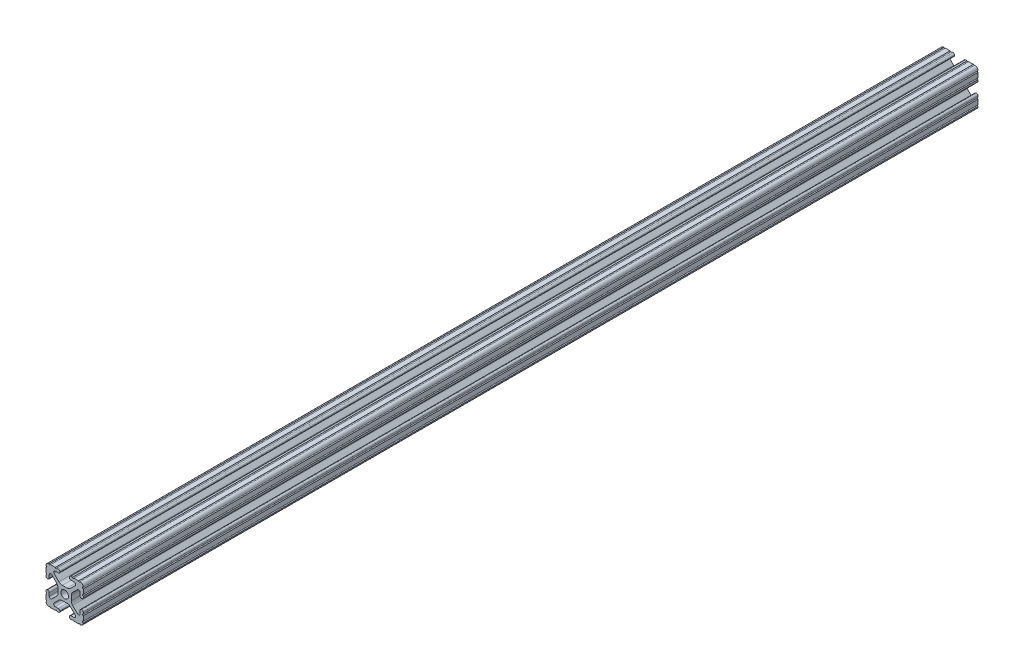
from build123d import *

# Parameters (mm, degrees)
SKETCH1_R           = 2.6035
BOSS_EXTRUDE1_DEPTH = 609.6


with BuildPart() as part:
    # Sketch1 → Boss-Extrude1 (new body)
    with BuildSketch(Plane(origin=(0, 0, -609.6), x_dir=(-1, 0, 0), z_dir=(0, 0, -1))):
        with BuildLine():
            Line((3.952270256, -5.423690504), (7.179650491, -8.645192518))
            ThreePointArc((7.179650491, -8.645192518), (7.41473082, -9.822813122), (6.416408326, -10.4902))
            Line((6.416408326, -10.4902), (4.287512408, -10.4902))
            ThreePointArc((4.287512408, -10.4902), (3.545748623, -10.79744862), (3.238500003, -11.539212405))
            Line((3.238500003, -11.539212405), (3.238500003, -11.650987595))
            ThreePointArc((3.238500003, -11.650987595), (3.545748623, -12.39275138), (4.287512408, -12.7))
            Line((4.287512408, -12.7), (5.317126732, -12.7))
            ThreePointArc((5.317126732, -12.7), (5.825126732, -12.192), (6.333126732, -12.7))
            Line((6.333126732, -12.7), (9.550443135, -12.7))
            ThreePointArc((9.550443135, -12.7), (10.058366883, -12.192000008), (10.566443107, -12.699847501))
            ThreePointArc((10.566443107, -12.699847501), (12.08253777, -12.082507268), (12.699846988, -10.566399977))
            ThreePointArc((12.699846988, -10.566399977), (12.192000032, -10.058323481), (12.700000025, -9.5504))
            Line((12.700000025, -9.5504), (12.700000025, -6.3330836))
            ThreePointArc((12.700000025, -6.3330836), (12.192000025, -5.8250836), (12.700000025, -5.3170836))
            Line((12.700000025, -5.3170836), (12.700000025, -4.287469302))
            ThreePointArc((12.700000025, -4.287469302), (12.392751402, -3.545705507), (11.650987607, -3.238456884))
            Line((11.650987607, -3.238456884), (11.539212418, -3.238456884))
            ThreePointArc((11.539212418, -3.238456884), (10.797448628, -3.545705505), (10.490200006, -4.287469295))
            Line((10.490200006, -4.287469295), (10.490200006, -6.402089022))
            ThreePointArc((10.490200006, -6.402089022), (9.856505079, -7.35106794), (8.737131356, -7.129408934))
            Line((8.737131356, -7.129408934), (5.441005839, -3.840816473))
            ThreePointArc((5.441005839, -3.840816473), (4.750877968, -2.809883099), (4.5085, -1.593185511))
            Line((4.5085, -1.593185511), (4.5085, 1.593185511))
            ThreePointArc((4.5085, 1.593185511), (4.750877968, 2.809883097), (5.441005836, 3.84081647))
            Line((5.441005836, 3.84081647), (8.737131354, 7.129408937))
            ThreePointArc((8.737131354, 7.129408937), (9.856505078, 7.351067944), (10.490200006, 6.402089026))
            Line((10.490200006, 6.402089026), (10.490200006, 4.287469295))
            ThreePointArc((10.490200006, 4.287469295), (10.797448628, 3.545705505), (11.539212418, 3.238456884))
            Line((11.539212418, 3.238456884), (11.650987607, 3.238456884))
            ThreePointArc((11.650987607, 3.238456884), (12.392751402, 3.545705507), (12.700000025, 4.287469302))
            Line((12.700000025, 4.287469302), (12.700000025, 5.3170836))
            ThreePointArc((12.700000025, 5.3170836), (12.192000025, 5.8250836), (12.700000025, 6.3330836))
            Line((12.700000025, 6.3330836), (12.700000025, 9.5504))
            ThreePointArc((12.700000025, 9.5504), (12.192000031, 10.058323481), (12.699846988, 10.566399977))
            ThreePointArc((12.699846988, 10.566399977), (12.082537769, 12.082507268), (10.566443107, 12.699847501))
            ThreePointArc((10.566443107, 12.699847501), (10.058366883, 12.192000008), (9.550443135, 12.7))
            Line((9.550443135, 12.7), (6.333126732, 12.7))
            ThreePointArc((6.333126732, 12.7), (5.825126732, 12.192), (5.317126732, 12.7))
            Line((5.317126732, 12.7), (4.287512408, 12.7))
            ThreePointArc((4.287512408, 12.7), (3.545748623, 12.39275138), (3.238500003, 11.650987595))
            Line((3.238500003, 11.650987595), (3.238500003, 11.539212405))
            ThreePointArc((3.238500003, 11.539212405), (3.545748623, 10.79744862), (4.287512408, 10.4902))
            Line((4.287512408, 10.4902), (6.476788589, 10.4902))
            ThreePointArc((6.476788589, 10.4902), (7.432222377, 9.851404219), (7.207036002, 8.72437056))
            Line((7.207036002, 8.72437056), (3.89827257, 5.423169047))
            ThreePointArc((3.89827257, 5.423169047), (2.869120215, 4.736787961), (1.655778398, 4.495799999))
            Line((1.655778398, 4.495799999), (-1.655778403, 4.495799999))
            ThreePointArc((-1.655778403, 4.495799999), (-2.86912022, 4.736787961), (-3.898272574, 5.423169047))
            Line((-3.898272574, 5.423169047), (-7.207036005, 8.724370563))
            ThreePointArc((-7.207036005, 8.724370563), (-7.43222238, 9.85140422), (-6.476788593, 10.4902))
            Line((-6.476788593, 10.4902), (-4.287512402, 10.4902))
            ThreePointArc((-4.287512402, 10.4902), (-3.545748617, 10.79744862), (-3.238499997, 11.539212405))
            Line((-3.238499997, 11.539212405), (-3.238499997, 11.650987595))
            ThreePointArc((-3.238499997, 11.650987595), (-3.545748617, 12.39275138), (-4.287512402, 12.7))
            Line((-4.287512402, 12.7), (-5.317126726, 12.7))
            ThreePointArc((-5.317126726, 12.7), (-5.825126726, 12.192), (-6.333126726, 12.7))
            Line((-6.333126726, 12.7), (-9.550443129, 12.7))
            ThreePointArc((-9.550443129, 12.7), (-10.058366877, 12.192000009), (-10.566443101, 12.699847501))
            ThreePointArc((-10.566443101, 12.699847501), (-12.082537764, 12.082507268), (-12.699846982, 10.566399977))
            ThreePointArc((-12.699846982, 10.566399977), (-12.192000006, 10.058323491), (-12.7, 9.5504))
            Line((-12.7, 9.5504), (-12.7, 6.3330836))
            ThreePointArc((-12.7, 6.3330836), (-12.192, 5.8250836), (-12.7, 5.3170836))
            Line((-12.7, 5.3170836), (-12.7, 4.287469302))
            ThreePointArc((-12.7, 4.287469302), (-12.392751376, 3.545705507), (-11.650987582, 3.238456884))
            Line((-11.650987582, 3.238456884), (-11.539212393, 3.238456884))
            ThreePointArc((-11.539212393, 3.238456884), (-10.797448603, 3.545705505), (-10.490199981, 4.287469295))
            Line((-10.490199981, 4.287469295), (-10.490199981, 6.402089031))
            ThreePointArc((-10.490199981, 6.402089031), (-9.856505054, 7.351067949), (-8.737131331, 7.129408942))
            Line((-8.737131331, 7.129408942), (-5.441005817, 3.840816485))
            ThreePointArc((-5.441005817, 3.840816485), (-4.750877946, 2.80988311), (-4.508499978, 1.593185522))
            Line((-4.508499978, 1.593185522), (-4.508499978, -1.593185505))
            ThreePointArc((-4.508499978, -1.593185505), (-4.750877945, -2.809883091), (-5.441005814, -3.840816464))
            Line((-5.441005814, -3.840816464), (-8.73713133, -7.129408929))
            ThreePointArc((-8.73713133, -7.129408929), (-9.856505053, -7.351067936), (-10.490199981, -6.402089018))
            Line((-10.490199981, -6.402089018), (-10.490199981, -4.287469295))
            ThreePointArc((-10.490199981, -4.287469295), (-10.797448603, -3.545705505), (-11.539212393, -3.238456884))
            Line((-11.539212393, -3.238456884), (-11.650987582, -3.238456884))
            ThreePointArc((-11.650987582, -3.238456884), (-12.392751376, -3.545705507), (-12.7, -4.287469302))
            Line((-12.7, -4.287469302), (-12.7, -5.3170836))
            ThreePointArc((-12.7, -5.3170836), (-12.192, -5.8250836), (-12.7, -6.3330836))
            Line((-12.7, -6.3330836), (-12.7, -9.5504))
            ThreePointArc((-12.7, -9.5504), (-12.192000006, -10.058323491), (-12.699846982, -10.566399977))
            ThreePointArc((-12.699846982, -10.566399977), (-12.082537763, -12.082507268), (-10.5664431, -12.699847501))
            ThreePointArc((-10.5664431, -12.699847501), (-10.058366877, -12.192000009), (-9.550443129, -12.7))
            Line((-9.550443129, -12.7), (-6.333126726, -12.7))
            ThreePointArc((-6.333126726, -12.7), (-5.825126726, -12.192), (-5.317126726, -12.7))
            Line((-5.317126726, -12.7), (-4.287512402, -12.7))
            ThreePointArc((-4.287512402, -12.7), (-3.545748617, -12.39275138), (-3.238499997, -11.650987595))
            Line((-3.238499997, -11.650987595), (-3.238499997, -11.539212405))
            ThreePointArc((-3.238499997, -11.539212405), (-3.545748617, -10.79744862), (-4.287512402, -10.4902))
            Line((-4.287512402, -10.4902), (-6.416408322, -10.4902))
            ThreePointArc((-6.416408322, -10.4902), (-7.414730817, -9.822813122), (-7.179650488, -8.645192518))
            Line((-7.179650488, -8.645192518), (-3.952270254, -5.423690504))
            ThreePointArc((-3.952270254, -5.423690504), (-2.922936451, -4.736929036), (-1.709253552, -4.495799998))
            Line((-1.709253552, -4.495799998), (1.709253555, -4.495799998))
            ThreePointArc((1.709253555, -4.495799998), (2.922936454, -4.736929036), (3.952270256, -5.423690504))
        make_face()
        Circle(SKETCH1_R, mode=Mode.SUBTRACT)
    extrude(amount=-BOSS_EXTRUDE1_DEPTH)


solid = part.part
